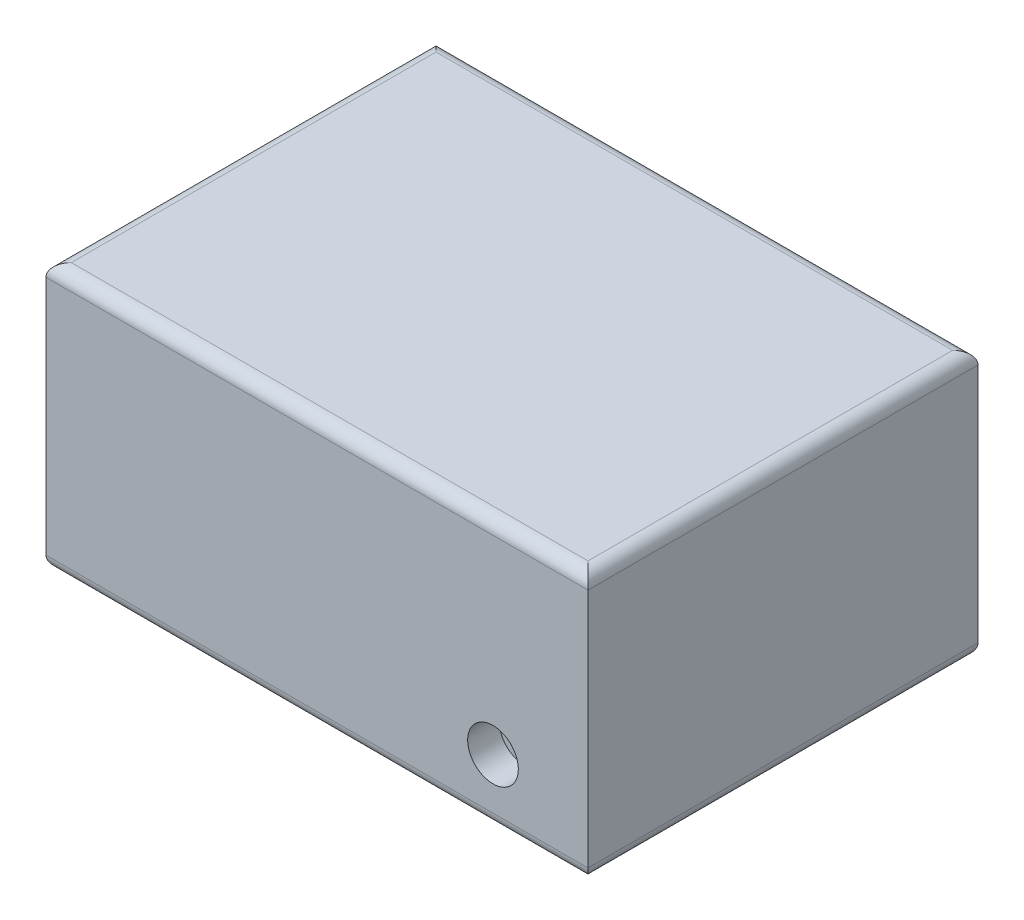
from build123d import *

# Parameters (mm, degrees)
SKETCH_1_W          = 85.6
SKETCH_1_H          = 61.6
EXTRUDE_1_DEPTH     = 42
SKETCH_2_R          = 4
CUT_EXTRUDE_1_DEPTH = 5
FILLET_1_R          = 2


with BuildPart() as part:
    # 草图1 → 凸台-拉伸1 (new body)
    with BuildSketch(Plane(origin=(0, 0, 0), x_dir=(1, 0, 0), z_dir=(0, 1, 0))):
        Rectangle(SKETCH_1_W, SKETCH_1_H)
    extrude(amount=EXTRUDE_1_DEPTH)

    # 草图2 → 切除-拉伸1 (cut)
    with BuildSketch(Plane.XY.offset(30.8)):
        with Locations((27.8, 10)):
            Circle(SKETCH_2_R)
    extrude(amount=-CUT_EXTRUDE_1_DEPTH, mode=Mode.SUBTRACT)

    # 圆角1
    fillet_1_edges = [part.edges().sort_by_distance(p)[0] for p in [
        (-42.8, 42, 0),
        (0, 42, 30.8),
        (42.8, 42, 0),
        (0, 0, 30.8),
        (-42.8, 0, 0),
        (0, 0, -30.8),
        (42.8, 0, 0),
        (0, 42, -30.8),
    ]]
    fillet(fillet_1_edges, radius=FILLET_1_R)


solid = part.part
